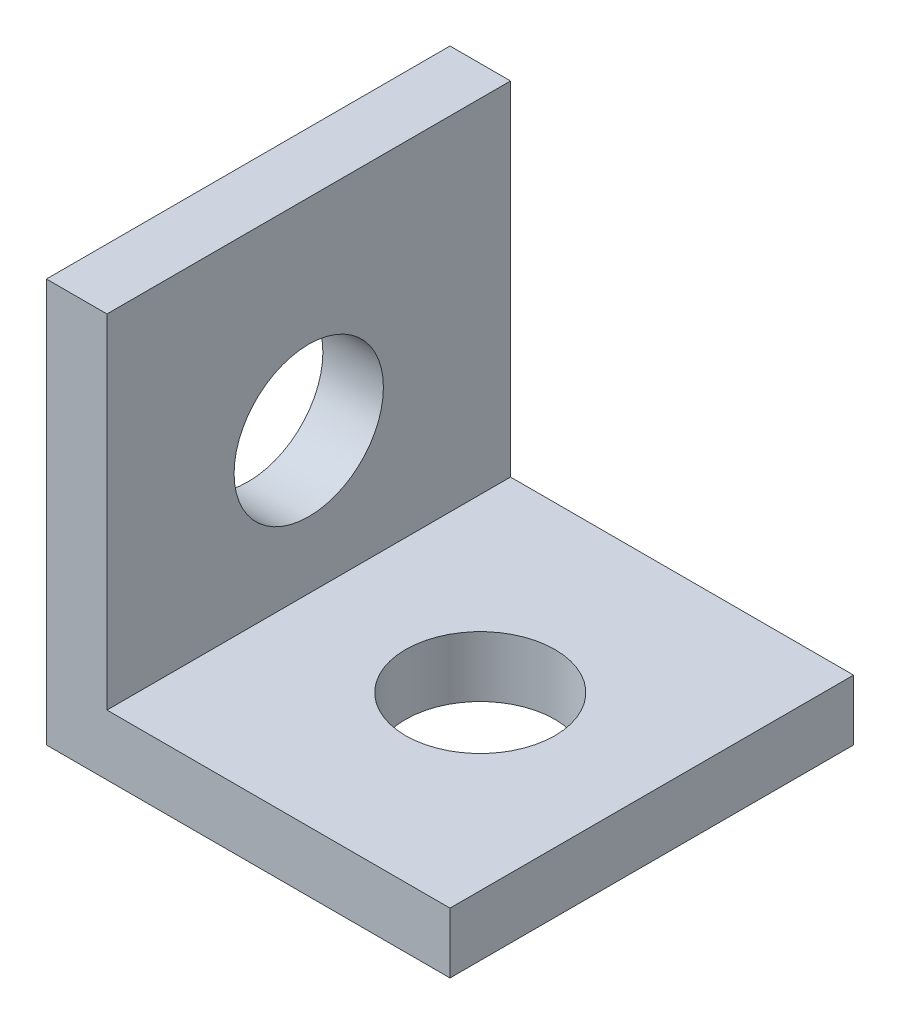
from build123d import *

# Parameters (mm, degrees)
BOSS_EXTRUDE1_DEPTH = 20
SKETCH2_R           = 3.7
CUT_EXTRUDE1_DEPTH  = 20
SKETCH3_R           = 3.7
CUT_EXTRUDE2_DEPTH  = 20


with BuildPart() as part:
    # Sketch1 → Boss-Extrude1 (new body)
    with BuildSketch(Plane.XY):
        Polygon((1.5, -10), (18.5, -10), (18.5, -7), (1.5, -7), (1.5, 10), (-1.5, 10), (-1.5, -10), align=None)
    extrude(amount=BOSS_EXTRUDE1_DEPTH)

    # Sketch2 → Cut-Extrude1 (cut)
    with BuildSketch(Plane(origin=(0, -7, 0), x_dir=(1, 0, 0), z_dir=(0, 1, 0))):
        with Locations(Location((10, -10, 0), (0, 0, 270))):
            Circle(SKETCH2_R)
    extrude(amount=-CUT_EXTRUDE1_DEPTH, mode=Mode.SUBTRACT)

    # Sketch3 → Cut-Extrude2 (cut)
    with BuildSketch(Plane(origin=(1.5, 0, 0), x_dir=(0, 0, -1), z_dir=(1, 0, 0))):
        with Locations(Location((-10, 0, 0), (0, 0, 90))):
            Circle(SKETCH3_R)
    extrude(amount=-CUT_EXTRUDE2_DEPTH, mode=Mode.SUBTRACT)


solid = part.part
